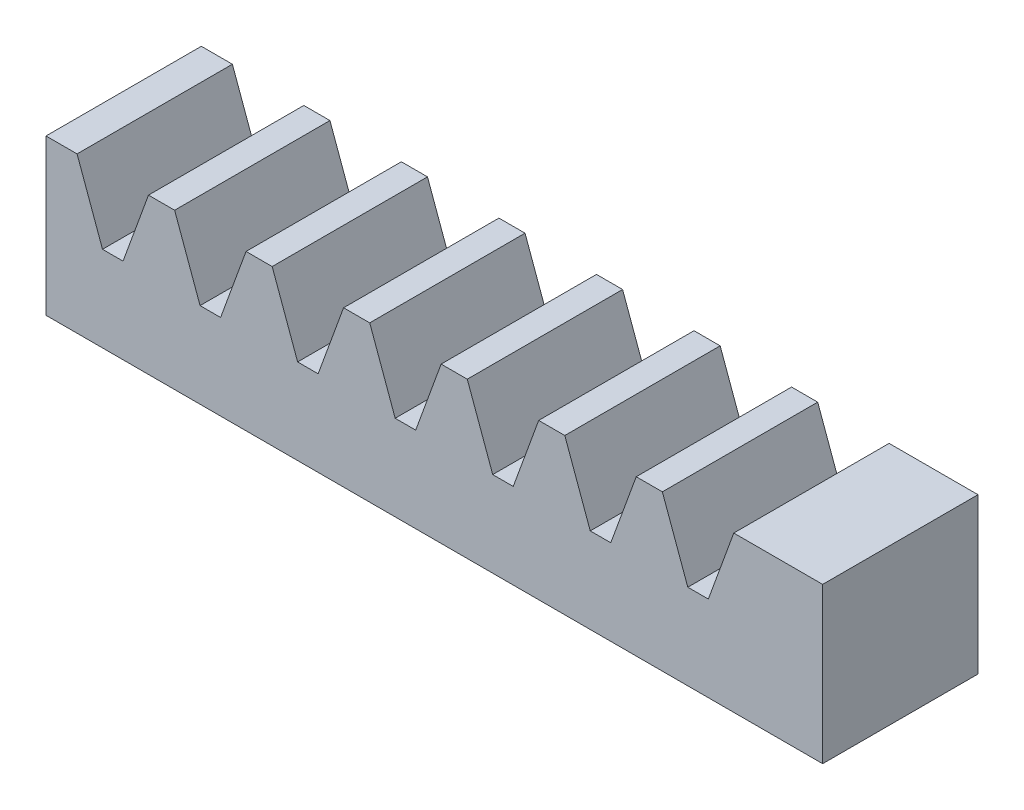
from build123d import *

# Parameters (mm, degrees)
SKETCH_1_W             = 50
SKETCH_1_H             = 10
EXTRUDE_1_DEPTH        = 10
CUT_EXTRUDE_1_DEPTH    = 52.961524227
PATTERN_LINEAR_1_COUNT = 7
PATTERN_LINEAR_1_PITCH = 6.28


with BuildPart() as part:
    # 草图1 → 凸台-拉伸1 (new body)
    with BuildSketch(Plane.XY):
        with Locations((25, 5)):
            Rectangle(SKETCH_1_W, SKETCH_1_H)
    extrude(amount=EXTRUDE_1_DEPTH)

    # 草图2 → 切除-拉伸1 (cut, through all)
    with BuildSketch(Plane.XY.offset(10)):
        Polygon((2, 10), (3.637866054, 5.5), (4.959614883, 5.5), (6.597480937, 10), align=None)
    cut_extrude_1 = extrude(amount=-CUT_EXTRUDE_1_DEPTH, mode=Mode.SUBTRACT)

    # 阵列(线性)1: 切除-拉伸1 ×7
    with Locations(*[(i * PATTERN_LINEAR_1_PITCH, 0, 0) for i in range(1, PATTERN_LINEAR_1_COUNT)]):
        add(cut_extrude_1, mode=Mode.SUBTRACT)


solid = part.part
